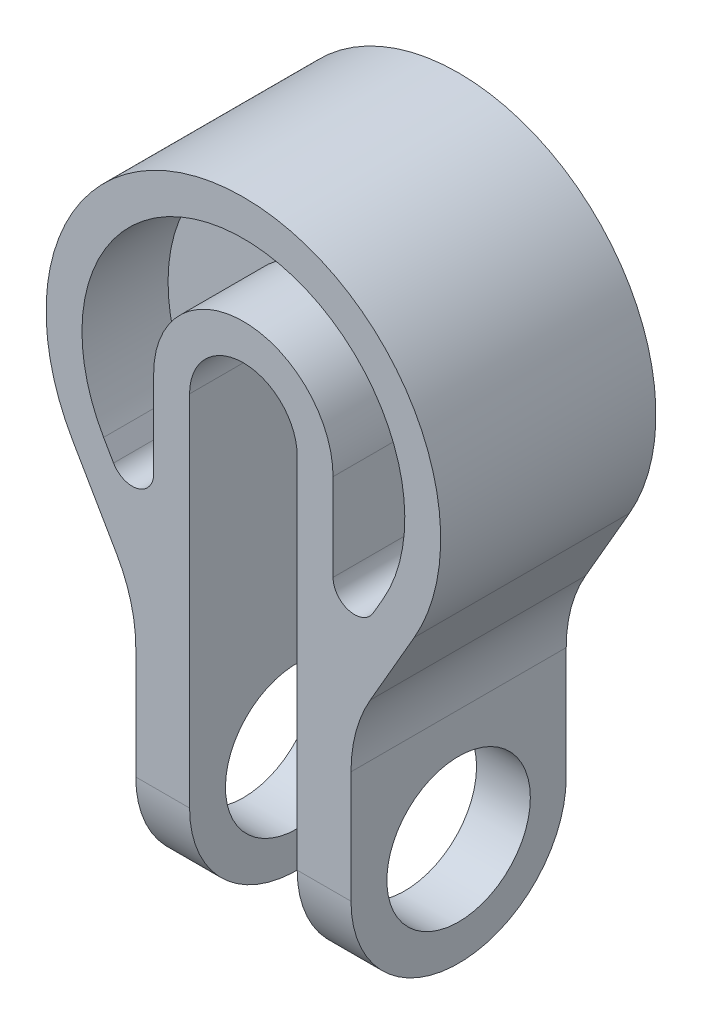
from build123d import *

# Parameters (mm, degrees)
BOSS_EXTRUDE1_DEPTH = 15
CUT_EXTRUDE1_DEPTH  = 12
CUT_EXTRUDE2_REACH  = 81.096
SKETCH3_R           = 10


with BuildPart() as part:
    # Sketch1 → Boss-Extrude1 (new body)
    with BuildSketch(Plane.XY):
        with BuildLine():
            Line((-7.5, 0), (-7.5, -65))
            Line((-7.5, -65), (-15, -65))
            Line((-15, -65), (-15, -42.295968202))
            Line((-15, -42.295968202), (-15, -34.378221735))
            ThreePointArc((-15, -34.378221735), (-15.681483474, -29.201840833), (-17.679491924, -24.378221735))
            Line((-17.679491924, -24.378221735), (-23.815698604, -13.75))
            ThreePointArc((-23.815698604, -13.75), (0, 27.5), (23.815698604, -13.75))
            Line((23.815698604, -13.75), (17.679491924, -24.378221735))
            ThreePointArc((17.679491924, -24.378221735), (15.681483474, -29.201840833), (15, -34.378221735))
            Line((15, -34.378221735), (15, -65))
            Line((15, -65), (7.5, -65))
            Line((7.5, -65), (7.5, 0))
            ThreePointArc((7.5, 0), (0, 7.5), (-7.5, 0))
        make_face()
    extrude(amount=BOSS_EXTRUDE1_DEPTH)

    # Sketch2 → Cut-Extrude1 (cut)
    with BuildSketch(Plane.XY.offset(15)):
        with BuildLine():
            Line((-12.5, 0), (-12.5, -12.153212483))
            ThreePointArc((-12.5, -12.153212483), (-14.723542865, -15.050989962), (-18.098076211, -13.653212483))
            Line((-18.098076211, -13.653212483), (-19.485571585, -11.25))
            ThreePointArc((-19.485571585, -11.25), (0, 22.5), (19.485571585, -11.25))
            Line((19.485571585, -11.25), (18.098076211, -13.653212483))
            ThreePointArc((18.098076211, -13.653212483), (14.723542865, -15.050989962), (12.5, -12.153212483))
            Line((12.5, -12.153212483), (12.5, 0))
            ThreePointArc((12.5, 0), (0, 12.5), (-12.5, 0))
        make_face()
    extrude(amount=-CUT_EXTRUDE1_DEPTH, mode=Mode.SUBTRACT)

    # Mirror1: part across plane


with BuildPart() as part_1:
    add(part.part)
    add(part.part.mirror(Plane.XY))

    # Sketch3 → Cut-Extrude2 (cut, up to next)
    with BuildSketch(Plane(origin=(15, 0, 0), x_dir=(0, 0, -1), z_dir=(1, 0, 0)), mode=Mode.PRIVATE) as cut_extrude2_sk1:
        with BuildLine():
            Line((15, -65), (15, -50))
            ThreePointArc((15, -50), (10.606601718, -60.606601718), (0, -65))
            Line((0, -65), (15, -65))
        make_face()
    cut_extrude2_tool1 = extrude(cut_extrude2_sk1.sketch, amount=-CUT_EXTRUDE2_REACH, mode=Mode.PRIVATE) & part_1.part
    # Sketch3 → Cut-Extrude2 (cut, up to next)
    with BuildSketch(Plane(origin=(15, 0, 0), x_dir=(0, 0, -1), z_dir=(1, 0, 0)), mode=Mode.PRIVATE) as cut_extrude2_sk2:
        with BuildLine():
            ThreePointArc((0, -65), (-10.606601718, -60.606601718), (-15, -50))
            Line((-15, -50), (-15, -65))
            Line((-15, -65), (0, -65))
        make_face()
    cut_extrude2_tool2 = extrude(cut_extrude2_sk2.sketch, amount=-CUT_EXTRUDE2_REACH, mode=Mode.PRIVATE) & part_1.part
    # Sketch3 → Cut-Extrude2 (cut, up to next)
    with BuildSketch(Plane(origin=(15, 0, 0), x_dir=(0, 0, -1), z_dir=(1, 0, 0)), mode=Mode.PRIVATE) as cut_extrude2_sk3:
        with Locations((0, -50)):
            Circle(SKETCH3_R)
    cut_extrude2_tool3 = extrude(cut_extrude2_sk3.sketch, amount=-CUT_EXTRUDE2_REACH, mode=Mode.PRIVATE) & part_1.part
    cut_extrude2_1 = cut_extrude2_tool1.solids().sort_by_distance((15, -61.649481, -11.649481))[0]
    add(cut_extrude2_1, mode=Mode.SUBTRACT)
    cut_extrude2_2 = cut_extrude2_tool2.solids().sort_by_distance((15, -61.649481, 11.649481))[0]
    add(cut_extrude2_2, mode=Mode.SUBTRACT)
    cut_extrude2_3 = cut_extrude2_tool3.solids().sort_by_distance((15, -50, 0))[0]
    add(cut_extrude2_3, mode=Mode.SUBTRACT)
    cut_extrude2 = cut_extrude2_1 + cut_extrude2_2 + cut_extrude2_3  # Cut-Extrude2 as one shape, for the pattern or mirror that repeats it

    # Mirror2: Cut-Extrude2 across plane
    add(cut_extrude2.mirror(Plane(origin=(0, 0, 0), x_dir=(0, 0, 1), z_dir=(1, 0, 0))), mode=Mode.SUBTRACT)


solid = part_1.part
